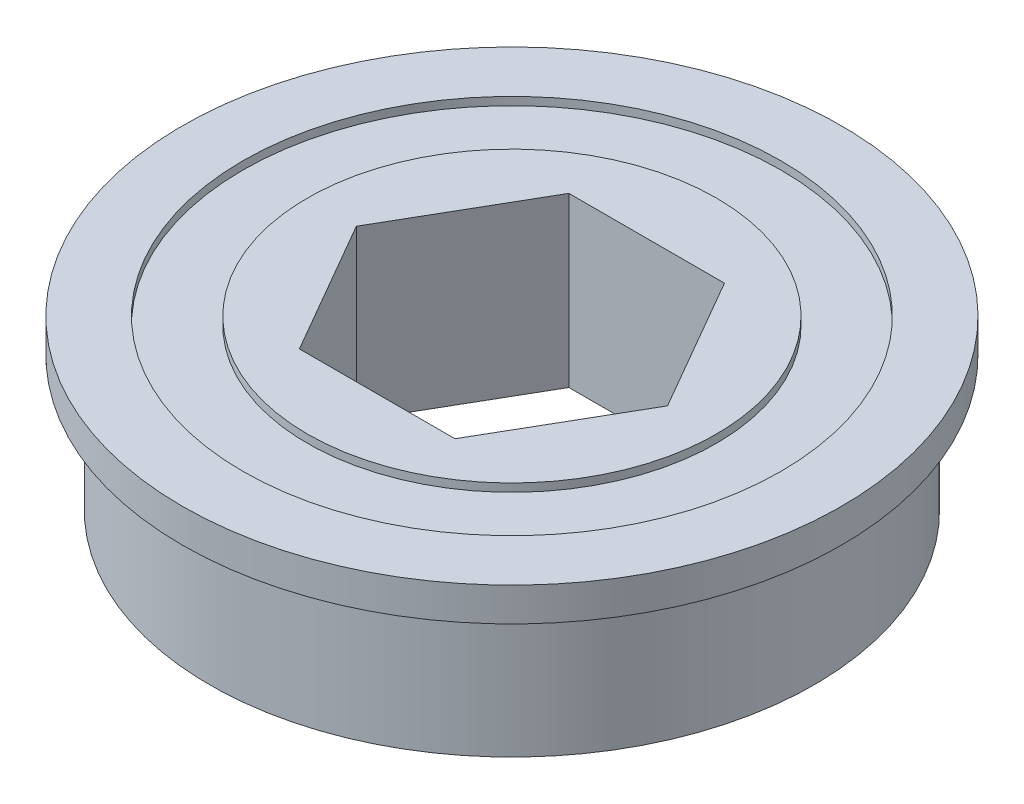
from build123d import *

# Parameters (mm, degrees)
SKETCH2_R           = 14.058293649
BOSS_EXTRUDE1_DEPTH = 0.375
BOSS_EXTRUDE1_DRAFT = -30
SKETCH3_R           = 14.2748
BOSS_EXTRUDE2_DEPTH = 5.6
SKETCH4_R           = 12.7
CUT_EXTRUDE1_DEPTH  = 0.381
SKETCH5_R           = 9.652
BOSS_EXTRUDE3_DEPTH = 0.381
CUT_EXTRUDE2_START  = -0.381
SKETCH6_R           = 12.7
CUT_EXTRUDE2_DEPTH  = 0.381
BOSS_EXTRUDE4_START = 0.381
SKETCH7_R           = 9.652
BOSS_EXTRUDE4_DEPTH = 0.381
CUT_EXTRUDE3_DEPTH  = 24.389645546


with BuildPart() as part:
    # Sketch1 → Revolve1 (revolve)
    with BuildSketch(Plane(origin=(0, 0, 0), x_dir=(-1, 0, 0), z_dir=(0, 0, -1))):
        with BuildLine():
            Line((-14.058293649, 5.975), (0, 5.975))
            Line((0, 5.975), (0, 7.9375))
            Line((0, 7.9375), (-15.5575, 7.9375))
            Line((-15.5575, 7.9375), (-15.5575, 6.35))
            Line((-15.5575, 6.35), (-14.2748, 6.35))
            ThreePointArc((-14.2748, 6.35), (-14.058293649, 6.225), (-14.058293649, 5.975))
        make_face()
    revolve(axis=Axis((0, 5.974975, 0), (0, 1, 0)))


with BuildPart() as boss_extrude1_tool:
    # Sketch2 → Boss-Extrude1 (with draft: the straight prism first)
    with BuildSketch(Plane.XZ.offset(-5.975)):
        Circle(SKETCH2_R)
    extrude(amount=BOSS_EXTRUDE1_DEPTH)
    # Boss-Extrude1: the draft: its side faces are tilted about the plane it starts from
    boss_extrude1_sides = [boss_extrude1_tool.faces().sort_by_distance(p)[0] for p in [
        (-14.058293649, 5.7875, 0),
    ]]
    draft(boss_extrude1_sides, Plane.XZ.offset(-5.975), BOSS_EXTRUDE1_DRAFT)


with BuildPart() as part_1:
    add(part.part)

    # Boss-Extrude1: add boss_extrude1_tool
    add(boss_extrude1_tool.part)

    # Sketch3 → Boss-Extrude2 (add)
    with BuildSketch(Plane.XZ.offset(-5.6)):
        Circle(SKETCH3_R)
    extrude(amount=BOSS_EXTRUDE2_DEPTH)

    # Sketch4 → Cut-Extrude1 (cut)
    with BuildSketch(Plane.XZ):
        Circle(SKETCH4_R)
    extrude(amount=-CUT_EXTRUDE1_DEPTH, mode=Mode.SUBTRACT)

    # Sketch5 → Boss-Extrude3 (add)
    with BuildSketch(Plane.XZ.offset(-0.381)):
        Circle(SKETCH5_R)
    extrude(amount=BOSS_EXTRUDE3_DEPTH)

    # Sketch6 → Cut-Extrude2 (cut)
    with BuildSketch(Plane(origin=(0, 7.9375, 0), x_dir=(-1, 0, 0), z_dir=(0, 1, 0)).offset(CUT_EXTRUDE2_START)):
        Circle(SKETCH6_R)
    extrude(amount=CUT_EXTRUDE2_DEPTH, mode=Mode.SUBTRACT)

    # Sketch7 → Boss-Extrude4 (add)
    with BuildSketch(Plane(origin=(0, 7.5565, 0), x_dir=(-1, 0, 0), z_dir=(0, 1, 0)).offset(BOSS_EXTRUDE4_START)):
        Circle(SKETCH7_R)
    extrude(amount=-BOSS_EXTRUDE4_DEPTH)

    # Sketch8 → Cut-Extrude3 (cut, through all)
    with BuildSketch(Plane(origin=(0, 7.9375, 0), x_dir=(-1, 0, 0), z_dir=(0, 1, 0))):
        Polygon((7.343895424, 0), (3.671947712, 6.36), (-3.671947712, 6.36), (-7.343895424, 0), (-3.671947712, -6.36), (3.671947712, -6.36), align=None)
    extrude(amount=-CUT_EXTRUDE3_DEPTH, mode=Mode.SUBTRACT)


solid = part_1.part
